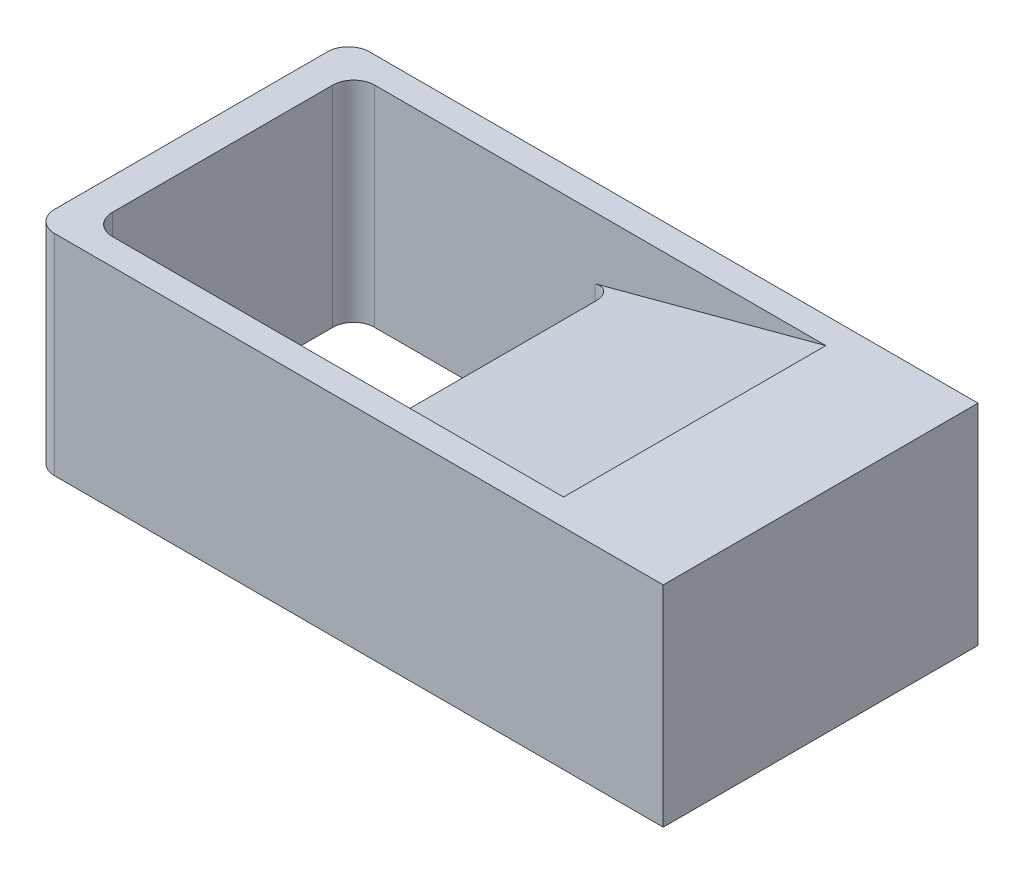
from build123d import *

# Parameters (mm, degrees)
CROQUIS1_W              = 30
CROQUIS1_H              = 15
CROQUIS1_W_2            = 12.5
CROQUIS1_H_2            = 12.5
SALIENTE_EXTRUIR1_DEPTH = 10
CHAFL_N1_SIZE           = 10
CHAFL_N1_SIZE2          = 2.679491924
REDONDEO1_R             = 1


with BuildPart() as part:
    # Croquis1 → Saliente-Extruir1 (new body)
    with BuildSketch(Plane(origin=(0, 0, 0), x_dir=(1, 0, 0), z_dir=(0, 1, 0))):
        with Locations((15, 7.5)):
            Rectangle(CROQUIS1_W, CROQUIS1_H)
        with Locations((7.75, 7.5)):
            Rectangle(CROQUIS1_W_2, CROQUIS1_H_2, mode=Mode.SUBTRACT)
    extrude(amount=SALIENTE_EXTRUIR1_DEPTH)

    # Chaflán1
    chafl_n1_edges = [part.edges().sort_by_distance(p)[0] for p in [
        (14, 10, -7.5),
    ]]
    chafl_n1_side = [part.faces().sort_by_distance(p)[0] for p in [
        (18.856382979, 10, -7.5),
    ]]
    chamfer(chafl_n1_edges, length=CHAFL_N1_SIZE, length2=CHAFL_N1_SIZE2, reference=chafl_n1_side[0])

    # Redondeo1
    redondeo1_edges = [part.edges().sort_by_distance(p)[0] for p in [
        (1.5, 5, -13.75),
        (1.5, 5, -1.25),
        (14, 3.660254038, -1.25),
        (14, 3.660254038, -13.75),
        (0, 5, -15),
        (0, 5, 0),
    ]]
    fillet(redondeo1_edges, radius=REDONDEO1_R)


solid = part.part
